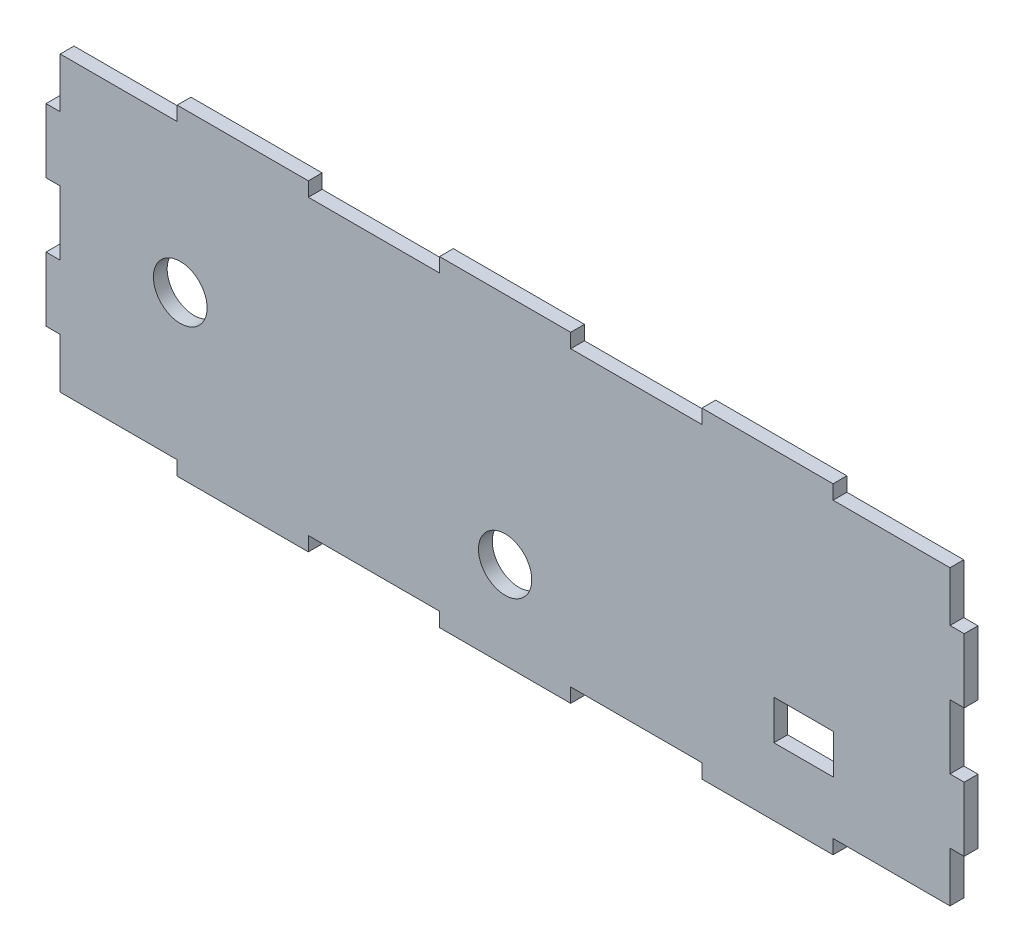
from build123d import *

# Parameters (mm, degrees)
SALIENTE_EXTRUIR2_DEPTH = 3
CROQUIS3_R              = 5.85
CORTAR_EXTRUIR1_DEPTH   = 3
CROQUIS4_W              = 13
CROQUIS4_H              = 8.6
CORTAR_EXTRUIR2_DEPTH   = 3
CROQUIS5_R              = 5.8
CORTAR_EXTRUIR3_DEPTH   = 3


with BuildPart() as part:
    # Croquis1 → Saliente-Extruir2 (new body)
    with BuildSketch(Plane.XY):
        Polygon((-71.428571429, -31.9), (-71.428571429, -35), (-42.857142857, -35), (-42.857142857, -31.9), (-14.285714286, -31.9), (-14.285714286, -35), (14.285714286, -35), (14.285714286, -31.9), (42.857142857, -31.9), (42.857142857, -35), (71.428571429, -35), (71.428571429, -31.9), (96.9, -31.9), (96.9, -21), (100, -21), (100, -7), (96.9, -7), (96.9, 7), (100, 7), (100, 21), (96.9, 21), (96.9, 31.9), (71.428571429, 31.9), (71.428571429, 35), (42.857142857, 35), (42.857142857, 31.9), (14.285714286, 31.9), (14.285714286, 35), (-14.285714286, 35), (-14.285714286, 31.9), (-42.857142857, 31.9), (-42.857142857, 35), (-71.428571429, 35), (-71.428571429, 31.9), (-96.9, 31.9), (-96.9, 21), (-100, 21), (-100, 7), (-96.9, 7), (-96.9, -7), (-100, -7), (-100, -21), (-96.9, -21), (-96.9, -31.9), align=None)
    extrude(amount=SALIENTE_EXTRUIR2_DEPTH)

    # Croquis3 → Cortar-Extruir1 (cut)
    with BuildSketch(Plane.XY.offset(3)):
        with Locations((-70.755124627, 0)):
            Circle(CROQUIS3_R)
    extrude(amount=-CORTAR_EXTRUIR1_DEPTH, mode=Mode.SUBTRACT)

    # Croquis4 → Cortar-Extruir2 (cut)
    with BuildSketch(Plane.XY.offset(3)):
        with Locations((65.03625281, -15.995927208)):
            Rectangle(CROQUIS4_W, CROQUIS4_H)
    extrude(amount=-CORTAR_EXTRUIR2_DEPTH, mode=Mode.SUBTRACT)

    # Croquis5 → Cortar-Extruir3 (cut)
    with BuildSketch(Plane(origin=(0, 0, 0), x_dir=(-1, 0, 0), z_dir=(0, 0, -1))):
        with Locations((0, -15.950666175)):
            Circle(CROQUIS5_R)
    extrude(amount=-CORTAR_EXTRUIR3_DEPTH, mode=Mode.SUBTRACT)


solid = part.part
